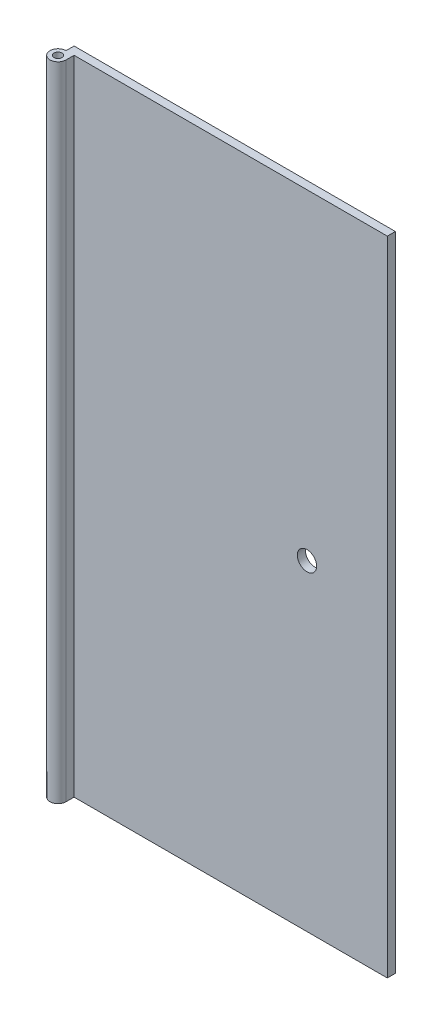
from build123d import *

# Parameters (mm, degrees)
ESQUISSE1_W             = 40
ESQUISSE1_H             = 80
BOSS_EXTRU_1_DEPTH      = 1
ESQUISSE2_R             = 0.5
BOSS_EXTRU_2_DEPTH      = 80
ESQUISSE3_W             = 3
ESQUISSE3_H             = 80
ENL_V_MAT_EXTRU_1_DEPTH = 90.98333179
D_GAGEMENT_M21_D        = 2.4


with BuildPart() as part:
    # Esquisse1 → Boss.-Extru.1 (new body)
    with BuildSketch(Plane.XY):
        with Locations((20, 40)):
            Rectangle(ESQUISSE1_W, ESQUISSE1_H)
    boss_extru_1 = extrude(amount=BOSS_EXTRU_1_DEPTH)

    # Esquisse2 → Boss.-Extru.2 (add)
    with BuildSketch(Plane(origin=(0, 80, 0), x_dir=(1, 0, 0), z_dir=(0, 1, 0))):
        with BuildLine():
            Line((1, 0), (1, 1))
            ThreePointArc((1, 1), (-0.707106781, 1.707106781), (0, 0))
            Line((0, 0), (1, 0))
        make_face()
        with Locations(Location((0, 1, 0), (0, 0, 270))):
            Circle(ESQUISSE2_R, mode=Mode.SUBTRACT)
    boss_extru_2 = extrude(amount=-BOSS_EXTRU_2_DEPTH)

    # Symétrie2: Boss.-Extru.1, Boss.-Extru.2 across plane
    add(boss_extru_1.mirror(Plane.XY.offset(1)))
    add(boss_extru_2.mirror(Plane.XY.offset(1)))

    # Esquisse3 → Enlèv. mat.-Extru.1 (cut, through all)
    with BuildSketch(Plane(origin=(40, 0, 0), x_dir=(0, 0, -1), z_dir=(1, 0, 0))):
        with Locations((0.5, 40)):
            Rectangle(ESQUISSE3_W, ESQUISSE3_H)
    extrude(amount=-ENL_V_MAT_EXTRU_1_DEPTH, mode=Mode.SUBTRACT)

    # Dégagement M21 (through all)
    with Locations(Plane.XY.offset(2)):
        with Locations((30, 40)):
            Hole(D_GAGEMENT_M21_D / 2)


solid = part.part
